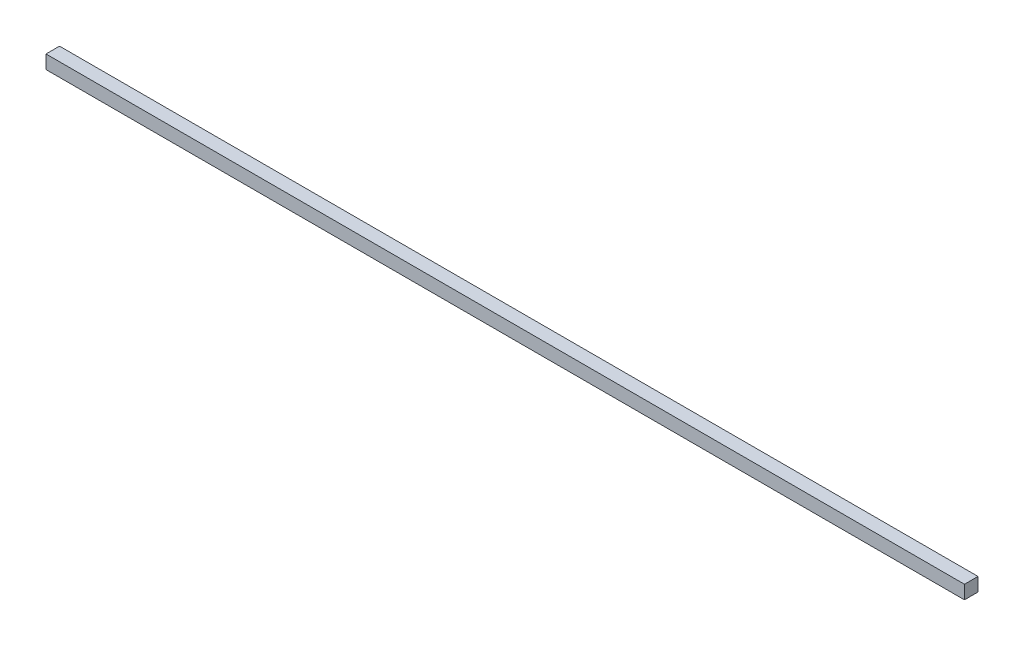
from build123d import *

# Parameters (mm, degrees)
SKETCH1_W           = 1357
SKETCH1_H           = 20
BOSS_EXTRUDE1_DEPTH = 20


with BuildPart() as part:
    # Sketch1 → Boss-Extrude1 (new body)
    with BuildSketch(Plane(origin=(0, 0, 0), x_dir=(1, 0, 0), z_dir=(0, 1, 0))):
        with Locations((678.5, 10)):
            Rectangle(SKETCH1_W, SKETCH1_H)
    extrude(amount=BOSS_EXTRUDE1_DEPTH)


solid = part.part
